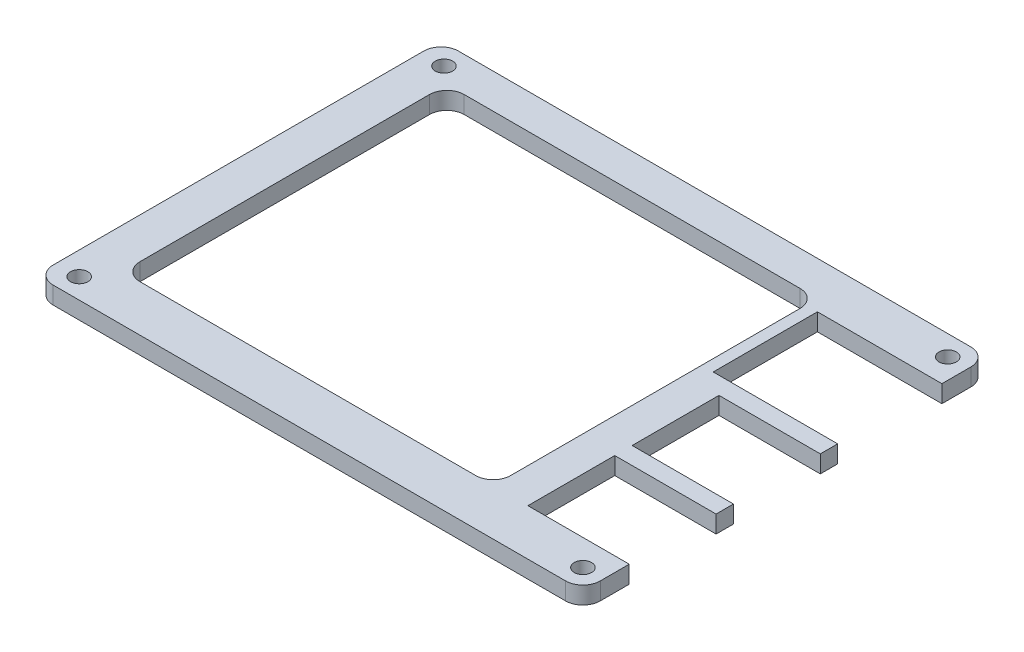
from build123d import *

# Parameters (mm, degrees)
SKETCH1_W           = 94.5
SKETCH1_H           = 70
BOSS_EXTRUDE1_DEPTH = 3
SKETCH3_R           = 1.5
CUT_EXTRUDE2_DEPTH  = 59.877521177
FILLET2_R           = 3
SKETCH5_W           = 64
SKETCH5_H           = 56
SKETCH5_W_2         = 21.5
SKETCH5_H_2         = 18
SKETCH5_W_3         = 17.5
SKETCH5_H_3         = 15
CUT_EXTRUDE3_DEPTH  = 59.877521177
FILLET3_R           = 3


with BuildPart() as part:
    # Sketch1 → Boss-Extrude1 (new body)
    with BuildSketch(Plane(origin=(0, 0, 0), x_dir=(1, 0, 0), z_dir=(0, 1, 0))):
        Rectangle(SKETCH1_W, SKETCH1_H)
    extrude(amount=BOSS_EXTRUDE1_DEPTH)

    # Sketch3 → Cut-Extrude2 (cut, through all)
    with BuildSketch(Plane(origin=(0, 3, 0), x_dir=(1, 0, 0), z_dir=(0, 1, 0))):
        with Locations(Location((43.75, 31.5, 0), (0, 0, 270))):
            Circle(SKETCH3_R)
        with Locations(Location((-43.25, 31.5, 0), (0, 0, 270))):
            Circle(SKETCH3_R)
        with Locations(Location((-43.25, -31.5, 0), (0, 0, 270))):
            Circle(SKETCH3_R)
        with Locations(Location((43.75, -31.5, 0), (0, 0, 270))):
            Circle(SKETCH3_R)
    extrude(amount=-CUT_EXTRUDE2_DEPTH, mode=Mode.SUBTRACT)

    # Fillet2
    fillet2_edges = [part.edges().sort_by_distance(p)[0] for p in [
        (47.25, 1.5, 35),
        (-47.25, 1.5, 35),
        (-47.25, 1.5, -35),
        (47.25, 1.5, -35),
    ]]
    fillet(fillet2_edges, radius=FILLET2_R)

    # Sketch5 → Cut-Extrude3 (cut, through all)
    with BuildSketch(Plane(origin=(0, 3, 0), x_dir=(1, 0, 0), z_dir=(0, 1, 0))):
        with Locations((-8.25, 1)):
            Rectangle(SKETCH5_W, SKETCH5_H)
        with Locations((36.5, 18)):
            Rectangle(SKETCH5_W_2, SKETCH5_H_2)
        with Locations((38.5, -1.5)):
            Rectangle(SKETCH5_W_3, SKETCH5_H_3)
        with Locations((38.5, -19.5)):
            Rectangle(SKETCH5_W_3, SKETCH5_H_3)
    extrude(amount=-CUT_EXTRUDE3_DEPTH, mode=Mode.SUBTRACT)

    # Fillet3
    fillet3_edges = [part.edges().sort_by_distance(p)[0] for p in [
        (-40.25, 1.5, 27),
        (-40.25, 1.5, -29),
        (23.75, 1.5, -29),
        (23.75, 1.5, 27),
    ]]
    fillet(fillet3_edges, radius=FILLET3_R)


solid = part.part
